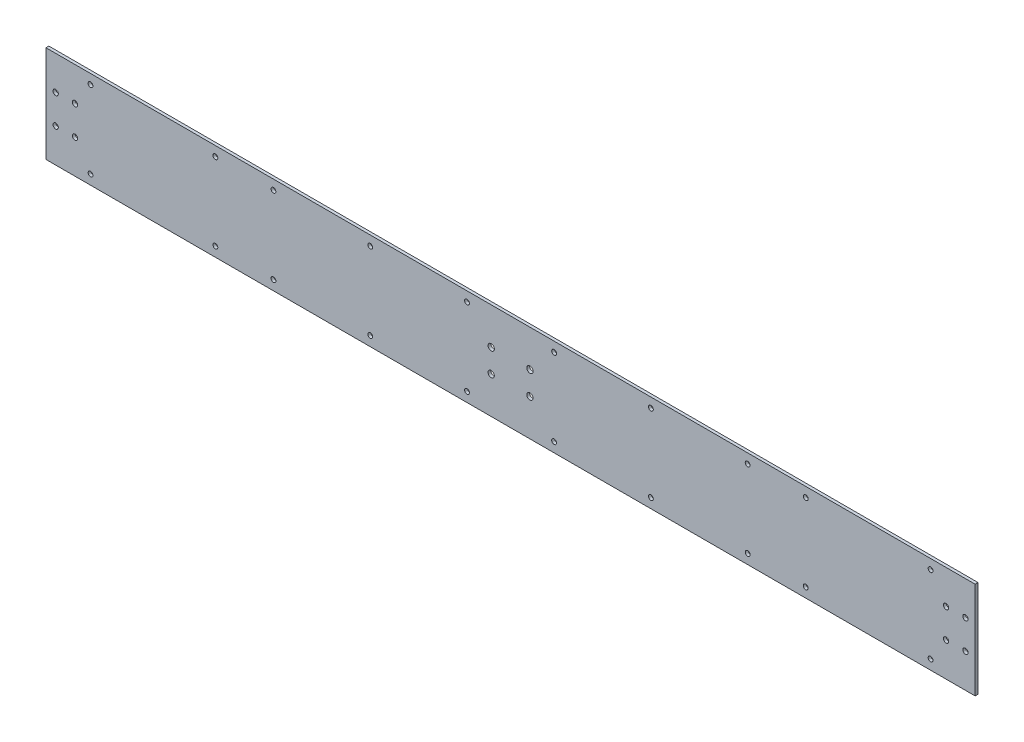
from build123d import *

# Parameters (mm, degrees)
SKIZZE1_W                       = 960
SKIZZE1_H                       = 100
AUFSATZ_LINEAR_AUSTRAGEN1_DEPTH = 3
SKIZZE2_R                       = 3.25
SCHNITT_LINEAR_AUSTRAGEN1_DEPTH = 10
SKIZZE3_R                       = 2.75
SCHNITT_LINEAR_AUSTRAGEN2_DEPTH = 10
SKIZZE4_R                       = 2.5
SCHNITT_LINEAR_AUSTRAGEN6_DEPTH = 10


with BuildPart() as part:
    # Skizze1 → Aufsatz-Linear austragen1 (new body)
    with BuildSketch(Plane.XY):
        with Locations((0, -50)):
            Rectangle(SKIZZE1_W, SKIZZE1_H)
    extrude(amount=AUFSATZ_LINEAR_AUSTRAGEN1_DEPTH)

    # Skizze2 → Schnitt-Linear austragen1 (cut)
    with BuildSketch(Plane.XY.offset(3)):
        with Locations((20, -38)):
            Circle(SKIZZE2_R)
        with Locations((-20, -38)):
            Circle(SKIZZE2_R)
        with Locations((20, -62)):
            Circle(SKIZZE2_R)
        with Locations((-20, -62)):
            Circle(SKIZZE2_R)
    extrude(amount=-SCHNITT_LINEAR_AUSTRAGEN1_DEPTH, mode=Mode.SUBTRACT)

    # Skizze3 → Schnitt-Linear austragen2 (cut)
    with BuildSketch(Plane.XY.offset(3)):
        with Locations((470, -35)):
            Circle(SKIZZE3_R)
        with Locations((450, -35)):
            Circle(SKIZZE3_R)
        with Locations((450, -65)):
            Circle(SKIZZE3_R)
        with Locations((470, -65)):
            Circle(SKIZZE3_R)
        with Locations((-470, -65)):
            Circle(SKIZZE3_R)
        with Locations((-450, -65)):
            Circle(SKIZZE3_R)
        with Locations((-470, -35)):
            Circle(SKIZZE3_R)
        with Locations((-450, -35)):
            Circle(SKIZZE3_R)
    extrude(amount=-SCHNITT_LINEAR_AUSTRAGEN2_DEPTH, mode=Mode.SUBTRACT)

    # Skizze4 → Schnitt-Linear austragen6 (cut)
    with BuildSketch(Plane.XY.offset(3)):
        with Locations((434, -10)):
            Circle(SKIZZE4_R)
        with Locations((305, -10)):
            Circle(SKIZZE4_R)
        with Locations((245, -10)):
            Circle(SKIZZE4_R)
        with Locations((145, -10)):
            Circle(SKIZZE4_R)
        with Locations((45, -10)):
            Circle(SKIZZE4_R)
        with Locations((434, -90)):
            Circle(SKIZZE4_R)
        with Locations((305, -90)):
            Circle(SKIZZE4_R)
        with Locations((245, -90)):
            Circle(SKIZZE4_R)
        with Locations((145, -90)):
            Circle(SKIZZE4_R)
        with Locations((45, -90)):
            Circle(SKIZZE4_R)
        with Locations((-434, -90)):
            Circle(SKIZZE4_R)
        with Locations((-434, -10)):
            Circle(SKIZZE4_R)
        with Locations((-305, -90)):
            Circle(SKIZZE4_R)
        with Locations((-305, -10)):
            Circle(SKIZZE4_R)
        with Locations((-245, -90)):
            Circle(SKIZZE4_R)
        with Locations((-245, -10)):
            Circle(SKIZZE4_R)
        with Locations((-145, -90)):
            Circle(SKIZZE4_R)
        with Locations((-145, -10)):
            Circle(SKIZZE4_R)
        with Locations((-45, -10)):
            Circle(SKIZZE4_R)
        with Locations((-45, -90)):
            Circle(SKIZZE4_R)
    extrude(amount=-SCHNITT_LINEAR_AUSTRAGEN6_DEPTH, mode=Mode.SUBTRACT)


solid = part.part
